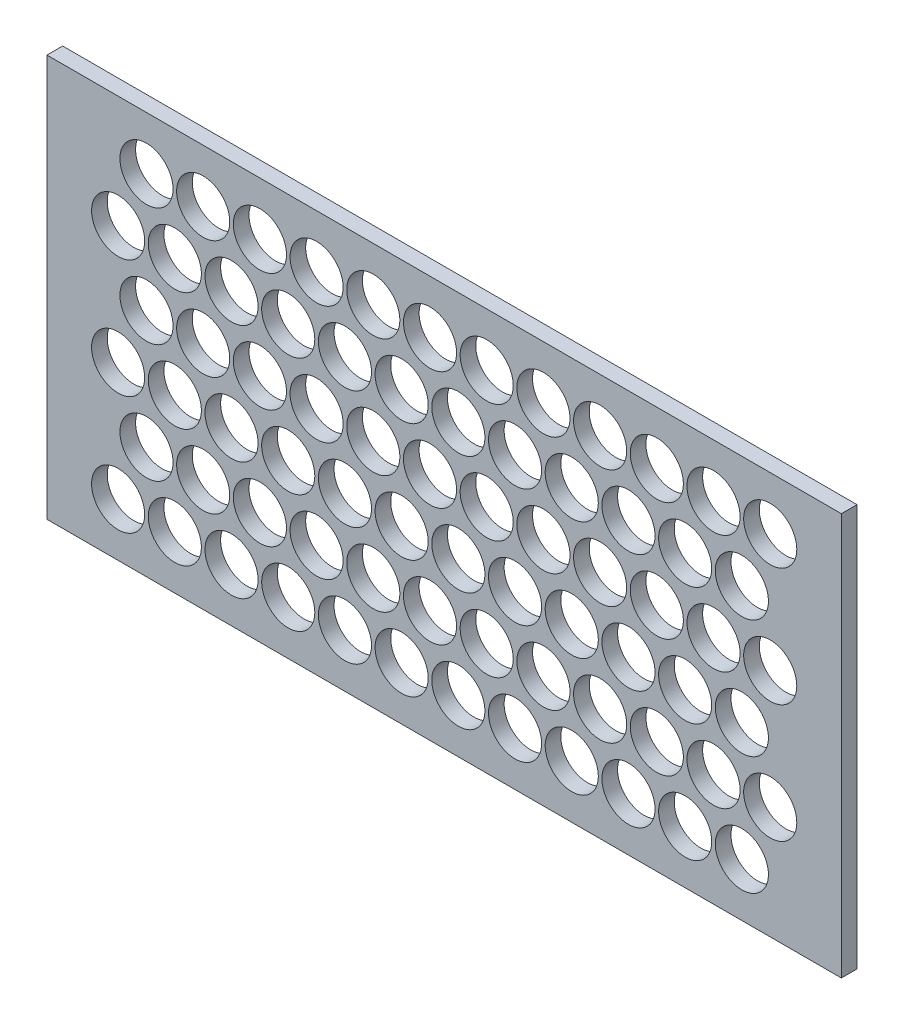
from build123d import *

# Parameters (mm, degrees)
SKETCH1_W           = 322.22857931
SKETCH1_H           = 163.1
BOSS_EXTRUDE1_DEPTH = 6.35
SKETCH2_R           = 10.775
CUT_EXTRUDE1_DEPTH  = 362.210727726


with BuildPart() as part:
    # Sketch1 → Boss-Extrude1 (new body)
    with BuildSketch(Plane.XY):
        with Locations((161.114289655, 81.55)):
            Rectangle(SKETCH1_W, SKETCH1_H)
    extrude(amount=BOSS_EXTRUDE1_DEPTH)

    # Sketch2 → Cut-Extrude1 (cut, through all)
    with BuildSketch(Plane.XY.offset(6.35)):
        with Locations((28.8625, 21.55)):
            Circle(SKETCH2_R)
        with Locations((40.366079306, 45.544994544)):
            Circle(SKETCH2_R)
        with Locations((51.8625, 21.55)):
            Circle(SKETCH2_R)
        with Locations((74.8625, 21.55)):
            Circle(SKETCH2_R)
        with Locations((97.8625, 21.55)):
            Circle(SKETCH2_R)
        with Locations((120.8625, 21.55)):
            Circle(SKETCH2_R)
        with Locations((143.8625, 21.55)):
            Circle(SKETCH2_R)
        with Locations((166.8625, 21.55)):
            Circle(SKETCH2_R)
        with Locations((189.8625, 21.55)):
            Circle(SKETCH2_R)
        with Locations((212.8625, 21.55)):
            Circle(SKETCH2_R)
        with Locations((235.8625, 21.55)):
            Circle(SKETCH2_R)
        with Locations((258.8625, 21.55)):
            Circle(SKETCH2_R)
        with Locations((281.8625, 21.55)):
            Circle(SKETCH2_R)
        with Locations((293.366079306, 45.544994544)):
            Circle(SKETCH2_R)
        with Locations((293.366079306, 93.544994544)):
            Circle(SKETCH2_R)
        with Locations((293.366079306, 141.544994544)):
            Circle(SKETCH2_R)
        with Locations((28.8625, 117.55)):
            Circle(SKETCH2_R)
        with Locations((28.8625, 69.55)):
            Circle(SKETCH2_R)
        with Locations((63.366079306, 45.544994544)):
            Circle(SKETCH2_R)
        with Locations((86.366079306, 45.544994544)):
            Circle(SKETCH2_R)
        with Locations((109.366079306, 45.544994544)):
            Circle(SKETCH2_R)
        with Locations((132.366079306, 45.544994544)):
            Circle(SKETCH2_R)
        with Locations((155.366079306, 45.544994544)):
            Circle(SKETCH2_R)
        with Locations((178.366079306, 45.544994544)):
            Circle(SKETCH2_R)
        with Locations((201.366079306, 45.544994544)):
            Circle(SKETCH2_R)
        with Locations((224.366079306, 45.544994544)):
            Circle(SKETCH2_R)
        with Locations((247.366079306, 45.544994544)):
            Circle(SKETCH2_R)
        with Locations((270.366079306, 45.544994544)):
            Circle(SKETCH2_R)
        with Locations((51.8625, 69.55)):
            Circle(SKETCH2_R)
        with Locations((74.8625, 69.55)):
            Circle(SKETCH2_R)
        with Locations((97.8625, 69.55)):
            Circle(SKETCH2_R)
        with Locations((120.8625, 69.55)):
            Circle(SKETCH2_R)
        with Locations((143.8625, 69.55)):
            Circle(SKETCH2_R)
        with Locations((166.8625, 69.55)):
            Circle(SKETCH2_R)
        with Locations((189.8625, 69.55)):
            Circle(SKETCH2_R)
        with Locations((212.8625, 69.55)):
            Circle(SKETCH2_R)
        with Locations((235.8625, 69.55)):
            Circle(SKETCH2_R)
        with Locations((258.8625, 69.55)):
            Circle(SKETCH2_R)
        with Locations((281.8625, 69.55)):
            Circle(SKETCH2_R)
        with Locations((51.8625, 117.55)):
            Circle(SKETCH2_R)
        with Locations((74.8625, 117.55)):
            Circle(SKETCH2_R)
        with Locations((97.8625, 117.55)):
            Circle(SKETCH2_R)
        with Locations((120.8625, 117.55)):
            Circle(SKETCH2_R)
        with Locations((143.8625, 117.55)):
            Circle(SKETCH2_R)
        with Locations((166.8625, 117.55)):
            Circle(SKETCH2_R)
        with Locations((189.8625, 117.55)):
            Circle(SKETCH2_R)
        with Locations((212.8625, 117.55)):
            Circle(SKETCH2_R)
        with Locations((235.8625, 117.55)):
            Circle(SKETCH2_R)
        with Locations((258.8625, 117.55)):
            Circle(SKETCH2_R)
        with Locations((281.8625, 117.55)):
            Circle(SKETCH2_R)
        with Locations((40.366079306, 93.544994544)):
            Circle(SKETCH2_R)
        with Locations((63.366079306, 93.544994544)):
            Circle(SKETCH2_R)
        with Locations((86.366079306, 93.544994544)):
            Circle(SKETCH2_R)
        with Locations((109.366079306, 93.544994544)):
            Circle(SKETCH2_R)
        with Locations((132.366079306, 93.544994544)):
            Circle(SKETCH2_R)
        with Locations((155.366079306, 93.544994544)):
            Circle(SKETCH2_R)
        with Locations((178.366079306, 93.544994544)):
            Circle(SKETCH2_R)
        with Locations((201.366079306, 93.544994544)):
            Circle(SKETCH2_R)
        with Locations((224.366079306, 93.544994544)):
            Circle(SKETCH2_R)
        with Locations((247.366079306, 93.544994544)):
            Circle(SKETCH2_R)
        with Locations((270.366079306, 93.544994544)):
            Circle(SKETCH2_R)
        with Locations((40.366079306, 141.544994544)):
            Circle(SKETCH2_R)
        with Locations((63.366079306, 141.544994544)):
            Circle(SKETCH2_R)
        with Locations((86.366079306, 141.544994544)):
            Circle(SKETCH2_R)
        with Locations((109.366079306, 141.544994544)):
            Circle(SKETCH2_R)
        with Locations((132.366079306, 141.544994544)):
            Circle(SKETCH2_R)
        with Locations((155.366079306, 141.544994544)):
            Circle(SKETCH2_R)
        with Locations((178.366079306, 141.544994544)):
            Circle(SKETCH2_R)
        with Locations((201.366079306, 141.544994544)):
            Circle(SKETCH2_R)
        with Locations((224.366079306, 141.544994544)):
            Circle(SKETCH2_R)
        with Locations((247.366079306, 141.544994544)):
            Circle(SKETCH2_R)
        with Locations((270.366079306, 141.544994544)):
            Circle(SKETCH2_R)
    extrude(amount=-CUT_EXTRUDE1_DEPTH, mode=Mode.SUBTRACT)


solid = part.part
